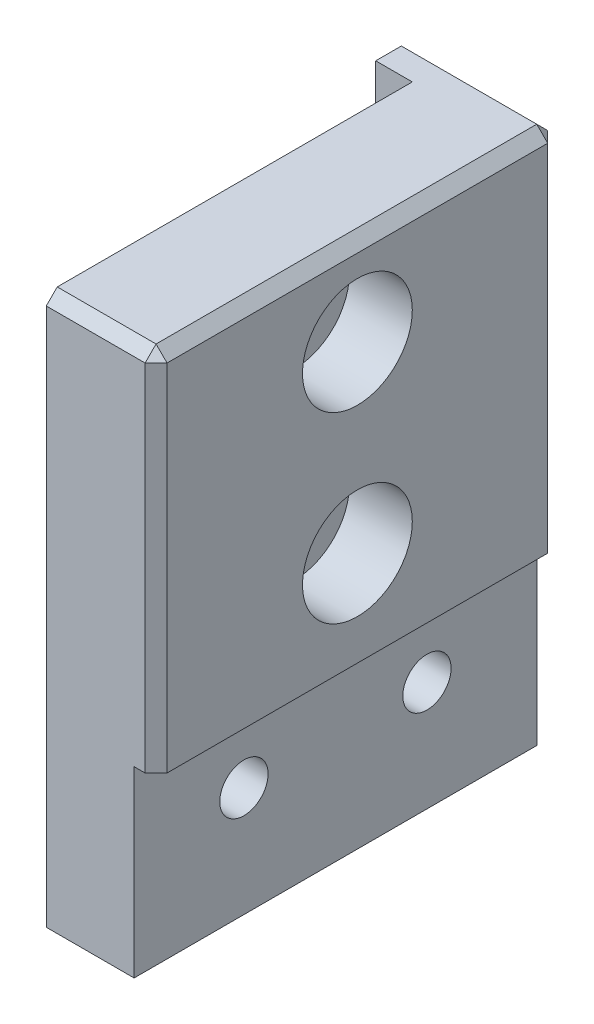
from build123d import *

# Parameters (mm, degrees)
BOSS_EXTRUDE1_DEPTH                                 = 55
SKETCH2_W                                           = 5
SKETCH2_H                                           = 70
BOSS_EXTRUDE2_DEPTH                                 = 5
M5_TAPPED_HOLE1_AT_2_COUNT                          = 2
M5_TAPPED_HOLE1_AT_2_PITCH                          = 20
M5_TAPPED_HOLE1_AT_3_COUNT                          = 2
M5_TAPPED_HOLE1_AT_3_PITCH                          = 40
M5_TAPPED_HOLE1_AT_4_COUNT                          = 2
M5_TAPPED_HOLE1_AT_4_PITCH                          = 60
SKETCH8_W                                           = 104.564197306
SKETCH8_H                                           = 46.562487895
CUT_EXTRUDE1_DEPTH                                  = 87
BOSS_EXTRUDE3_DEPTH                                 = 5
SKETCH10_W                                          = 55
SKETCH10_H                                          = 20
CUT_EXTRUDE2_DEPTH                                  = 3
CBORE_FOR_M6_HEX_SOCKET_HEAD_CAP_SCREW1_D           = 6.6
CBORE_FOR_M6_HEX_SOCKET_HEAD_CAP_SCREW1_CBORE_D     = 11
CBORE_FOR_M6_HEX_SOCKET_HEAD_CAP_SCREW1_CBORE_DEPTH = 6.4
SKETCH13_W                                          = 55
SKETCH13_H                                          = 20
CUT_EXTRUDE3_DEPTH                                  = 5
SKETCH14_W                                          = 5
SKETCH14_H                                          = 55
CUT_EXTRUDE4_DEPTH                                  = 210
SKETCH15_W                                          = 3
SKETCH15_H                                          = 5
CUT_EXTRUDE5_DEPTH                                  = 210
CBORE_FOR_M8_HEX_SOCKET_HEAD_CAP_SCREW1_D           = 9
CBORE_FOR_M8_HEX_SOCKET_HEAD_CAP_SCREW1_CBORE_D     = 15
CBORE_FOR_M8_HEX_SOCKET_HEAD_CAP_SCREW1_CBORE_DEPTH = 8.6
SKETCH18_W                                          = 5
SKETCH18_H                                          = 75
CUT_EXTRUDE6_DEPTH                                  = 210
CHAMFER1_SIZE                                       = 1.5


with BuildPart() as part:
    # Sketch1 → Boss-Extrude1 (new body)
    with BuildSketch(Plane.XY):
        Polygon((0, 0), (110, 0), (110, 20), (20, 20), (20, 70), (0, 70), align=None)
    extrude(amount=BOSS_EXTRUDE1_DEPTH)

    # Sketch2 → Boss-Extrude2 (add)
    with BuildSketch(Plane.ZY):
        with Locations((52.5, 35)):
            Rectangle(SKETCH2_W, SKETCH2_H)
        with Locations((2.5, 35)):
            Rectangle(SKETCH2_W, SKETCH2_H)
    extrude(amount=BOSS_EXTRUDE2_DEPTH)

    # Sketch4 → M5 Tapped Hole1 (revolve, cut)
    with BuildSketch(Plane(origin=(100, 12.5, 55), x_dir=(0, -1, 0), z_dir=(1, 0, 0))):
        Polygon((0, 0), (0, 15.2618073), (2.1, 14), (2.1, 0), align=None)
    m5_tapped_hole1 = revolve(axis=Axis((100, 12.5, 61.35), (0, 0, -1)), mode=Mode.SUBTRACT)

    # M5 Tapped Hole1 at 2: M5 Tapped Hole1 ×2
    with Locations(*[(-i * M5_TAPPED_HOLE1_AT_2_PITCH, 0, 0) for i in range(1, M5_TAPPED_HOLE1_AT_2_COUNT)]):
        add(m5_tapped_hole1, mode=Mode.SUBTRACT)

    # M5 Tapped Hole1 at 3: M5 Tapped Hole1 ×2
    with Locations(*[(-i * M5_TAPPED_HOLE1_AT_3_PITCH, 0, 0) for i in range(1, M5_TAPPED_HOLE1_AT_3_COUNT)]):
        add(m5_tapped_hole1, mode=Mode.SUBTRACT)

    # M5 Tapped Hole1 at 4: M5 Tapped Hole1 ×2
    with Locations(*[(-i * M5_TAPPED_HOLE1_AT_4_PITCH, 0, 0) for i in range(1, M5_TAPPED_HOLE1_AT_4_COUNT)]):
        add(m5_tapped_hole1, mode=Mode.SUBTRACT)

    # Mirror1: M5 Tapped Hole1 across plane
    add(m5_tapped_hole1.mirror(Plane.XY.offset(27.5)), mode=Mode.SUBTRACT)

    # Mirror1 copy 1 sketch → Mirror1 copy 1 (revolve, cut)
    with BuildSketch(Plane(origin=(80, 12.5, 0), x_dir=(0, -1, 0), z_dir=(1, 0, 0))):
        Polygon((0, 0), (0, -15.2618073), (2.1, -14), (2.1, 0), align=None)
    revolve(axis=Axis((80, 12.5, -6.35), (0, 0, -1)), mode=Mode.SUBTRACT)

    # Mirror1 copy 2 sketch → Mirror1 copy 2 (revolve, cut)
    with BuildSketch(Plane(origin=(60, 12.5, 0), x_dir=(0, -1, 0), z_dir=(1, 0, 0))):
        Polygon((0, 0), (0, -15.2618073), (2.1, -14), (2.1, 0), align=None)
    revolve(axis=Axis((60, 12.5, -6.35), (0, 0, -1)), mode=Mode.SUBTRACT)

    # Mirror1 copy 3 sketch → Mirror1 copy 3 (revolve, cut)
    with BuildSketch(Plane(origin=(40, 12.5, 0), x_dir=(0, -1, 0), z_dir=(1, 0, 0))):
        Polygon((0, 0), (0, -15.2618073), (2.1, -14), (2.1, 0), align=None)
    revolve(axis=Axis((40, 12.5, -6.35), (0, 0, -1)), mode=Mode.SUBTRACT)

    # Sketch8 → Cut-Extrude1 (cut)
    with BuildSketch(Plane.XY.offset(55)):
        with Locations((72.282098653, 13.535500523)):
            Rectangle(SKETCH8_W, SKETCH8_H)
    extrude(amount=-CUT_EXTRUDE1_DEPTH, mode=Mode.SUBTRACT)

    # Sketch9 → Boss-Extrude3 (add)
    with BuildSketch(Plane.XZ):
        Polygon((-5, 55), (-5, 50), (0, 50), (0, 5), (-5, 5), (-5, 0), (20, 0), (20, 55), align=None)
    extrude(amount=BOSS_EXTRUDE3_DEPTH)

    # Sketch10 → Cut-Extrude2 (cut)
    with BuildSketch(Plane(origin=(20, 0, 0), x_dir=(0, 0, -1), z_dir=(1, 0, 0))):
        with Locations((-27.5, 10)):
            Rectangle(SKETCH10_W, SKETCH10_H)
    extrude(amount=-CUT_EXTRUDE2_DEPTH, mode=Mode.SUBTRACT)

    # CBORE for M6 Hex Socket Head Cap Screw1 (through all)
    with Locations(Plane.ZY):
        with Locations((15, 10), (40, 10)):
            CounterBoreHole(CBORE_FOR_M6_HEX_SOCKET_HEAD_CAP_SCREW1_D / 2, CBORE_FOR_M6_HEX_SOCKET_HEAD_CAP_SCREW1_CBORE_D / 2, CBORE_FOR_M6_HEX_SOCKET_HEAD_CAP_SCREW1_CBORE_DEPTH)

    # Sketch13 → Cut-Extrude3 (cut)
    with BuildSketch(Plane(origin=(17, 0, 0), x_dir=(0, 0, -1), z_dir=(1, 0, 0))):
        with Locations((-27.5, 10)):
            Rectangle(SKETCH13_W, SKETCH13_H)
    extrude(amount=-CUT_EXTRUDE3_DEPTH, mode=Mode.SUBTRACT)

    # Sketch14 → Cut-Extrude4 (cut)
    with BuildSketch(Plane(origin=(0, 70, 0), x_dir=(1, 0, 0), z_dir=(0, 1, 0))):
        with Locations((17.5, -27.5)):
            Rectangle(SKETCH14_W, SKETCH14_H)
    extrude(amount=-CUT_EXTRUDE4_DEPTH, mode=Mode.SUBTRACT)

    # Sketch15 → Cut-Extrude5 (cut)
    with BuildSketch(Plane.XY.offset(55)):
        with Locations((13.5, -2.5)):
            Rectangle(SKETCH15_W, SKETCH15_H)
    extrude(amount=-CUT_EXTRUDE5_DEPTH, mode=Mode.SUBTRACT)

    # CBORE for M8 Hex Socket Head Cap Screw1 (through all)
    with Locations(Plane(origin=(15, 0, 0), x_dir=(0, 0, -1), z_dir=(1, 0, 0))):
        with Locations((-27.5, 58), (-27.5, 33)):
            CounterBoreHole(CBORE_FOR_M8_HEX_SOCKET_HEAD_CAP_SCREW1_D / 2, CBORE_FOR_M8_HEX_SOCKET_HEAD_CAP_SCREW1_CBORE_D / 2, CBORE_FOR_M8_HEX_SOCKET_HEAD_CAP_SCREW1_CBORE_DEPTH)

    # Sketch18 → Cut-Extrude6 (cut)
    with BuildSketch(Plane(origin=(0, 0, 50), x_dir=(-1, 0, 0), z_dir=(0, 0, -1))):
        with Locations((2.5, 32.5)):
            Rectangle(SKETCH18_W, SKETCH18_H)
    extrude(amount=-CUT_EXTRUDE6_DEPTH, mode=Mode.SUBTRACT)

    # Chamfer1
    chamfer1_edges = [part.edges().sort_by_distance(p)[0] for p in [
        (5, 70, 0),
        (7.5, 70, 55),
        (15, 45, 55),
        (15, 45, 0),
        (15, 70, 27.5),
    ]]
    chamfer(chamfer1_edges, length=CHAMFER1_SIZE)


solid = part.part
